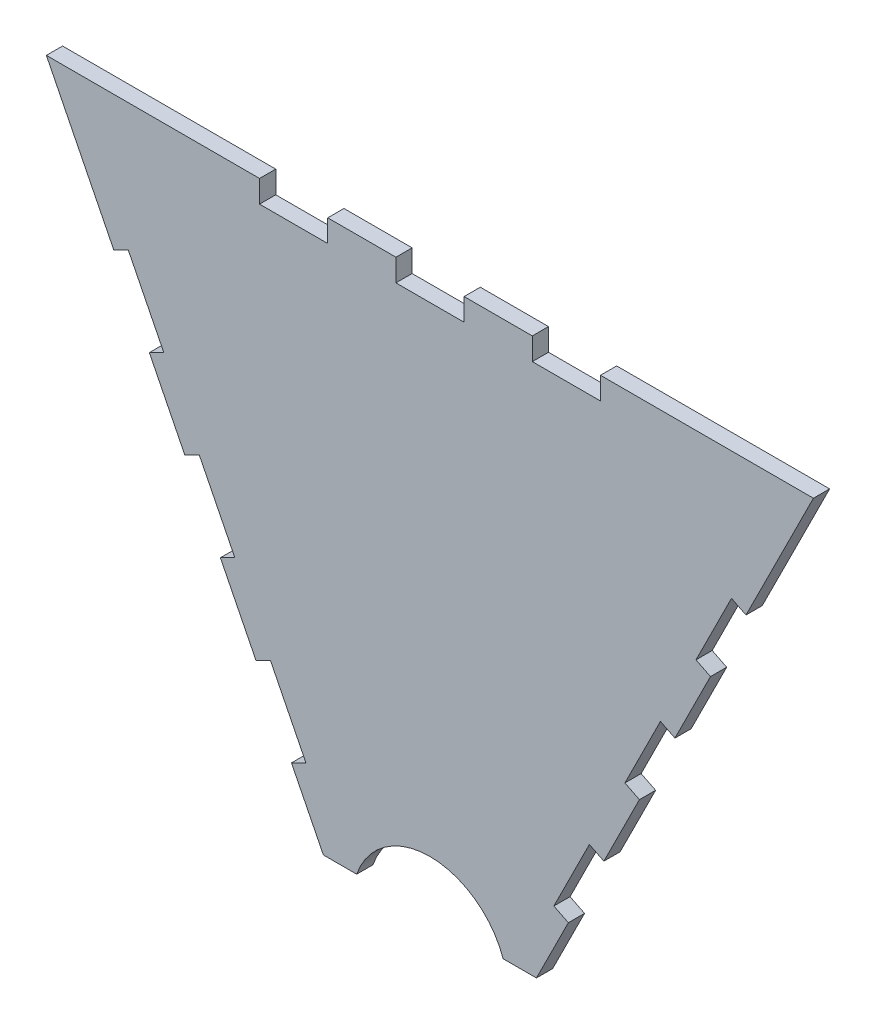
from build123d import *

# Parameters (mm, degrees)
BOSS_EXTRUDE1_DEPTH = 4.826
CUT_EXTRUDE1_DEPTH  = 283.027055929
SKETCH3_R           = 23.114
CUT_EXTRUDE2_DEPTH  = 4.826
SKETCH4_W           = 20.32
SKETCH4_H           = 4.617249963
CUT_EXTRUDE3_DEPTH  = 283.027055929
SKETCH5_W           = 20.32
SKETCH5_H           = 4.826
CUT_EXTRUDE4_DEPTH  = 283.027055929


with BuildPart() as part:
    # Sketch1 → Boss-Extrude1 (new body)
    with BuildSketch(Plane.XY):
        Polygon((228.6, 165.1), (0, 165.1), (82.55, 0), (146.05, 0), align=None)
    extrude(amount=BOSS_EXTRUDE1_DEPTH)

    # Sketch2 → Cut-Extrude1 (cut, through all)
    with BuildSketch(Plane.XY.offset(4.826)):
        Polygon((20.097936797, 124.904126406), (24.414442421, 127.062379218), (35.002974022, 105.885316015), (30.686468399, 103.727063203), align=None)
        Polygon((41.275, 82.55), (45.591505624, 84.708252812), (56.180037225, 63.531189609), (51.863531601, 61.372936797), align=None)
        Polygon((62.452063203, 40.195873594), (66.768568827, 42.354126406), (77.357100428, 21.177063203), (73.040594804, 19.018810391), align=None)
        Polygon((155.559405196, 19.018810391), (166.147936797, 40.195873594), (161.831431173, 42.354126406), (151.242899572, 21.177063203), align=None)
        Polygon((176.736468399, 61.372936797), (187.325, 82.55), (183.008494376, 84.708252812), (172.419962775, 63.531189609), align=None)
        Polygon((197.913531601, 103.727063203), (208.502063203, 124.904126406), (204.185557579, 127.062379218), (193.597025978, 105.885316015), align=None)
    extrude(amount=-CUT_EXTRUDE1_DEPTH, mode=Mode.SUBTRACT)

    # Sketch3 → Cut-Extrude2 (cut)
    with BuildSketch(Plane.XY.offset(4.826)):
        with Locations((114.3, -7.62)):
            Circle(SKETCH3_R)
    extrude(amount=-CUT_EXTRUDE2_DEPTH, mode=Mode.SUBTRACT)

    # Sketch4 → Cut-Extrude3 (cut, through all)
    with BuildSketch(Plane.XY.offset(4.826)):
        with Locations((154.974498273, 165.599419735)):
            Rectangle(SKETCH4_W, SKETCH4_H)
        with Locations((114.334498273, 165.599419735)):
            Rectangle(SKETCH4_W, SKETCH4_H)
        with Locations((73.694498273, 165.599419735)):
            Rectangle(SKETCH4_W, SKETCH4_H)
    extrude(amount=-CUT_EXTRUDE3_DEPTH, mode=Mode.SUBTRACT)

    # Sketch5 → Cut-Extrude4 (cut, through all)
    with BuildSketch(Plane.XY.offset(4.826)):
        with Locations((154.974498273, 160.877794753)):
            Rectangle(SKETCH5_W, SKETCH5_H)
        with Locations((114.334498273, 160.877794753)):
            Rectangle(SKETCH5_W, SKETCH5_H)
        with Locations((73.694498273, 160.877794753)):
            Rectangle(SKETCH5_W, SKETCH5_H)
    extrude(amount=-CUT_EXTRUDE4_DEPTH, mode=Mode.SUBTRACT)


solid = part.part
